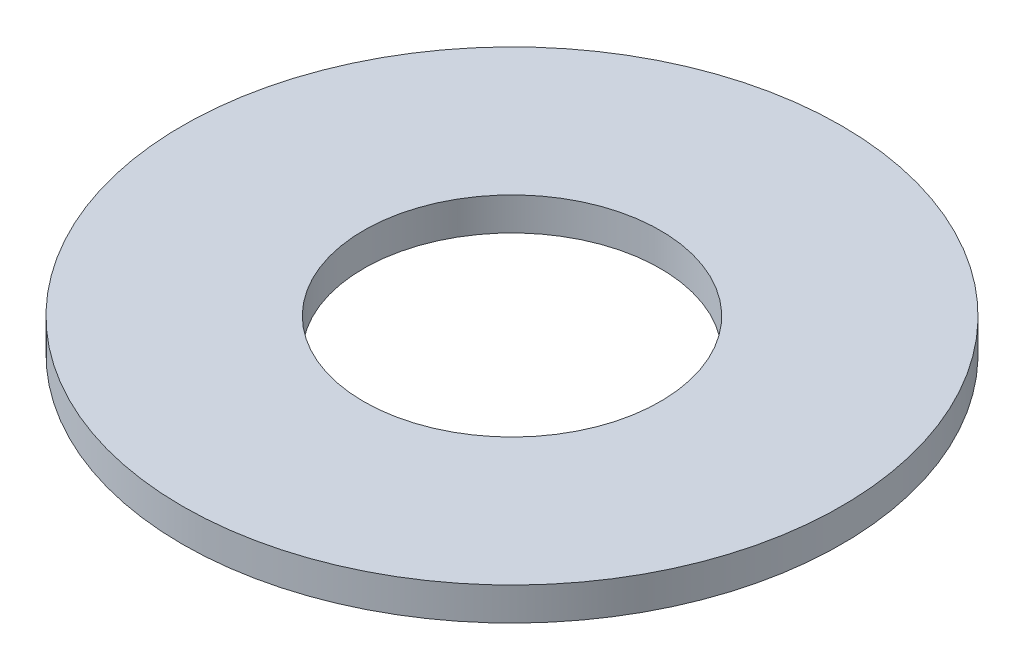
from build123d import *

# Parameters (mm, degrees)
SKETCH1_R           = 5
SKETCH1_R_2         = 2.25
BOSS_EXTRUDE1_DEPTH = 0.5


with BuildPart() as part:
    # Sketch1 → Boss-Extrude1 (new body)
    with BuildSketch(Plane(origin=(0, 0, 0), x_dir=(1, 0, 0), z_dir=(0, 1, 0))):
        with Locations(Location((0, 0, 0), (0, 0, 270))):
            Circle(SKETCH1_R)
        with Locations(Location((0, 0, 0), (0, 0, 270))):
            Circle(SKETCH1_R_2, mode=Mode.SUBTRACT)
    extrude(amount=BOSS_EXTRUDE1_DEPTH)


solid = part.part
